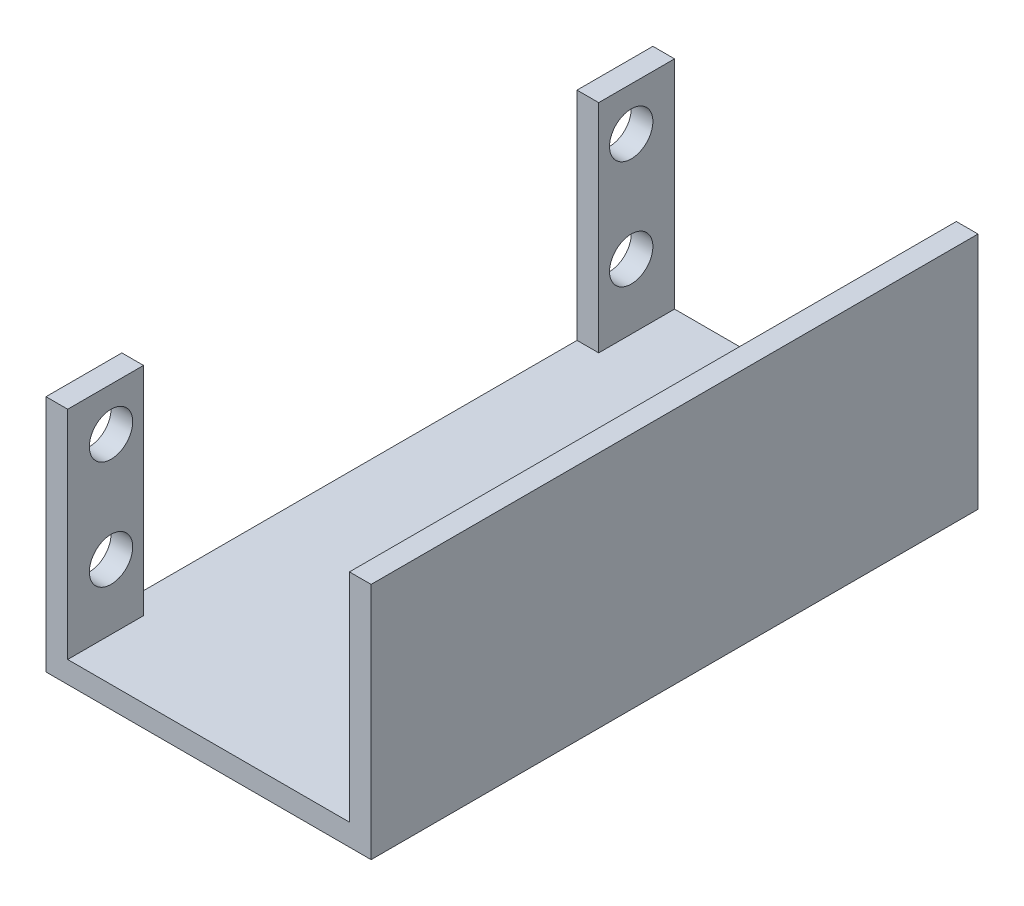
from build123d import *

# Parameters (mm, degrees)
SKETCH_1_W          = 2
SKETCH_1_H          = 20
SKETCH_1_W_2        = 30
SKETCH_1_H_2        = 2
EXTRUDE_1_DEPTH     = 28
SKETCH_2_W          = 42
SKETCH_2_H          = 20
CUT_EXTRUDE_1_DEPTH = 39.078865529
CUT_EXTRUDE_3_REACH = 48.098
SKETCH_3_R          = 2


with BuildPart() as part:
    # 草图1 → 凸台-拉伸1 (new, symmetric)
    with BuildSketch(Plane.XY):
        with Locations((-14, 11)):
            Rectangle(SKETCH_1_W, SKETCH_1_H)
        Rectangle(SKETCH_1_W_2, SKETCH_1_H_2)
        with Locations((14, 11)):
            Rectangle(SKETCH_1_W, SKETCH_1_H)
    extrude(amount=EXTRUDE_1_DEPTH, both=True)

    # 草图2 → 切除-拉伸1 (cut, through all)
    with BuildSketch(Plane(origin=(0, 0, 0), x_dir=(0, 0, -1), z_dir=(1, 0, 0))):
        with Locations((0, 11)):
            Rectangle(SKETCH_2_W, SKETCH_2_H)
    extrude(amount=-CUT_EXTRUDE_1_DEPTH, mode=Mode.SUBTRACT)

    # 草图3 → 切除-拉伸3 (cut, up to next)
    with BuildSketch(Plane.ZY.offset(15), mode=Mode.PRIVATE) as cut_extrude_3_sk1:
        with Locations((-24, 17)):
            Circle(SKETCH_3_R)
    cut_extrude_3_tool1 = extrude(cut_extrude_3_sk1.sketch, amount=-CUT_EXTRUDE_3_REACH, mode=Mode.PRIVATE) & part.part
    # 草图3 → 切除-拉伸3 (cut, up to next)
    with BuildSketch(Plane.ZY.offset(15), mode=Mode.PRIVATE) as cut_extrude_3_sk2:
        with Locations((-24, 7)):
            Circle(SKETCH_3_R)
    cut_extrude_3_tool2 = extrude(cut_extrude_3_sk2.sketch, amount=-CUT_EXTRUDE_3_REACH, mode=Mode.PRIVATE) & part.part
    # 草图3 → 切除-拉伸3 (cut, up to next)
    with BuildSketch(Plane.ZY.offset(15), mode=Mode.PRIVATE) as cut_extrude_3_sk3:
        with Locations((24, 7)):
            Circle(SKETCH_3_R)
    cut_extrude_3_tool3 = extrude(cut_extrude_3_sk3.sketch, amount=-CUT_EXTRUDE_3_REACH, mode=Mode.PRIVATE) & part.part
    # 草图3 → 切除-拉伸3 (cut, up to next)
    with BuildSketch(Plane.ZY.offset(15), mode=Mode.PRIVATE) as cut_extrude_3_sk4:
        with Locations((24, 17)):
            Circle(SKETCH_3_R)
    cut_extrude_3_tool4 = extrude(cut_extrude_3_sk4.sketch, amount=-CUT_EXTRUDE_3_REACH, mode=Mode.PRIVATE) & part.part
    add(cut_extrude_3_tool1.solids().sort_by_distance((-15, 17, -24))[0], mode=Mode.SUBTRACT)
    add(cut_extrude_3_tool2.solids().sort_by_distance((-15, 7, -24))[0], mode=Mode.SUBTRACT)
    add(cut_extrude_3_tool3.solids().sort_by_distance((-15, 7, 24))[0], mode=Mode.SUBTRACT)
    add(cut_extrude_3_tool4.solids().sort_by_distance((-15, 17, 24))[0], mode=Mode.SUBTRACT)


solid = part.part
